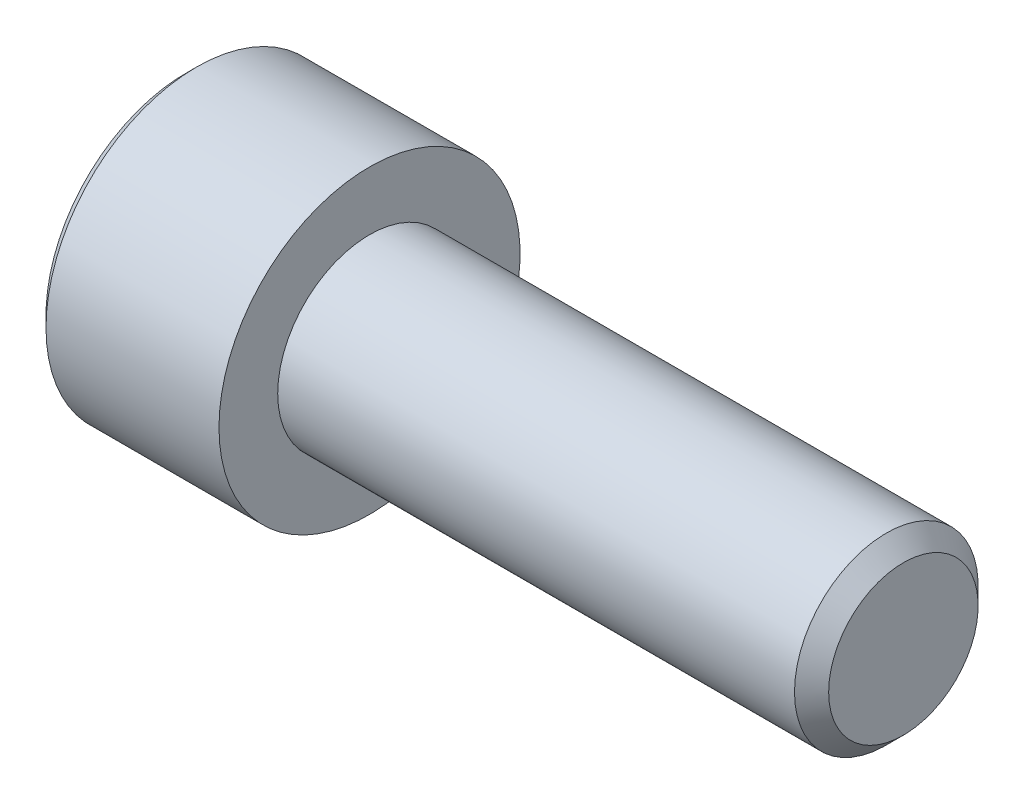
from build123d import *

# Parameters (mm, degrees)
CHAMFER1_SIZE      = 0.2032
CHAMFER2_SIZE      = 0.127
CUT_EXTRUDE1_DEPTH = 1.5494


with BuildPart() as part:
    # Sketch1 → Revolve1 (revolve)
    with BuildSketch(Plane.XY, mode=Mode.PRIVATE) as revolve1_sk:
        Polygon((-2.1844, 0), (6.35, 0), (6.35, 1.0922), (0, 1.0922), (0, 1.7907), (-2.1844, 1.7907), align=None)
    revolve(revolve1_sk.sketch.rotate(Axis((-2.1844, 0, 0), (1, 0, 0)), 90), axis=Axis((-2.1844, 0, 0), (1, 0, 0)))

    # Chamfer1
    chamfer1_edges = [part.edges().sort_by_distance(p)[0] for p in [
        (6.35, 0, -1.0922),
    ]]
    chamfer(chamfer1_edges, length=CHAMFER1_SIZE)

    # Chamfer2
    chamfer2_edges = [part.edges().sort_by_distance(p)[0] for p in [
        (-2.1844, 0, -1.7907),
    ]]
    chamfer(chamfer2_edges, length=CHAMFER2_SIZE)

    # Sketch2 → Cut-Extrude1 (cut)
    with BuildSketch(Plane.ZY.offset(2.1844)):
        Polygon((1.100183814, 0.178167419), (0.395794396, 1.041870841), (-0.704389418, 0.863703422), (-1.100183814, -0.178167419), (-0.395794396, -1.041870841), (0.704389418, -0.863703422), align=None)
    extrude(amount=-CUT_EXTRUDE1_DEPTH, mode=Mode.SUBTRACT)


solid = part.part
